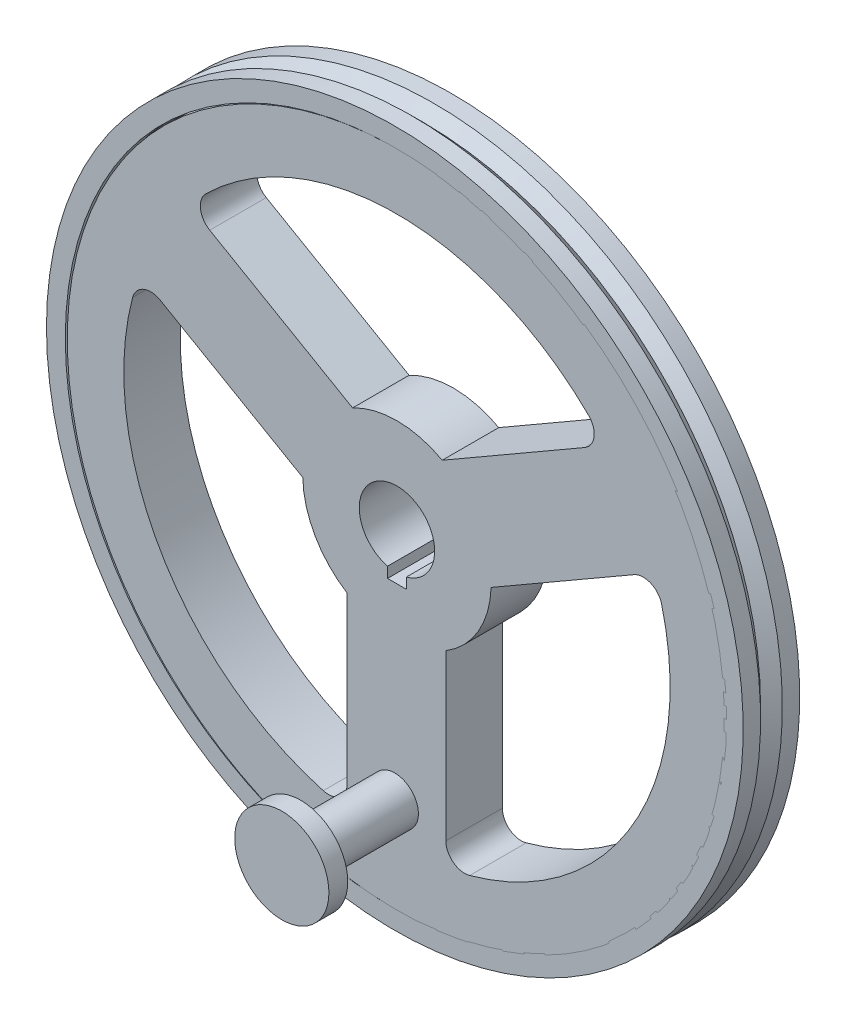
from build123d import *

# Parameters (mm, degrees)
SKETCH1_R           = 175
BOSS_EXTRUDE1_DEPTH = 30
SKETCH2_R           = 12.5
BOSS_EXTRUDE2_DEPTH = 50
SKETCH3_R           = 25
BOSS_EXTRUDE3_DEPTH = 10


with BuildPart() as part:
    # Sketch1 → Boss-Extrude1 (new body)
    with BuildSketch(Plane.XY):
        with Locations((1.124570284, 0)):
            Circle(SKETCH1_R)
        with BuildLine():
            Line((-25.294489225, -42.450362715), (-25.294489225, -129.994815683))
            ThreePointArc((-25.294489225, -129.994815683), (-29.252017923, -137.962785347), (-37.992197337, -139.624061289))
            ThreePointArc((-37.992197337, -139.624061289), (-124.579527681, -72.273644953), (-139.221399367, 36.441855094))
            ThreePointArc((-139.221399367, 36.441855094), (-133.404983694, 43.152516168), (-124.542366978, 42.588877746))
            Line((-124.542366978, 42.588877746), (-48.863229184, -1.104492831))
            ThreePointArc((-48.863229184, -1.104492831), (-42.313572676, -24.761416281), (-25.294489225, -42.450362715))
        make_face(mode=Mode.SUBTRACT)
        with BuildLine():
            Line((27.074988868, -130.125198957), (27.074988868, -42.738457802))
            ThreePointArc((27.074988868, -42.738457802), (44.287657296, -25.237827156), (51.09719255, -1.654395321))
            Line((51.09719255, -1.654395321), (126.91291278, 42.117831162))
            ThreePointArc((126.91291278, 42.117831162), (135.792141274, 42.674495606), (141.60093815, 35.935916171))
            ThreePointArc((141.60093815, 35.935916171), (126.567431819, -72.726119721), (39.737982837, -139.764102584))
            ThreePointArc((39.737982837, -139.764102584), (31.018172034, -138.082269388), (27.074988868, -130.125198957))
        make_face(mode=Mode.SUBTRACT)
        with BuildLine():
            ThreePointArc((21.124570284, 0), (16.935958585, -12.247448714), (6.124570284, -19.364916731))
            Line((6.124570284, -19.364916731), (6.124570284, -25))
            Line((6.124570284, -25), (-3.875429716, -25))
            Line((-3.875429716, -25), (-3.875429716, -19.364916731))
            ThreePointArc((-3.875429716, -19.364916731), (-11.12287843, 15.811388301), (21.124570284, 0))
        make_face(mode=Mode.SUBTRACT)
        with BuildLine():
            Line((-22.428992473, 44.104758037), (-98.244712703, 87.876984521))
            ThreePointArc((-98.244712703, 87.876984521), (-103.1664125, 95.288289741), (-100.235029962, 103.688145118))
            ThreePointArc((-100.235029962, 103.688145118), (1.385806713, 144.999764674), (102.857127382, 103.322247489))
            ThreePointArc((102.857127382, 103.322247489), (105.760522511, 94.929753221), (100.841088961, 87.536321211))
            Line((100.841088961, 87.536321211), (25.161951167, 43.842950634))
            ThreePointArc((25.161951167, 43.842950634), (1.399626231, 49.999243437), (-22.428992473, 44.104758037))
        make_face(mode=Mode.SUBTRACT)
    extrude(amount=BOSS_EXTRUDE1_DEPTH)

    # Sketch2 → Boss-Extrude2 (add)
    with BuildSketch(Plane.XY.offset(30)):
        with Locations((0, -125)):
            Circle(SKETCH2_R)
    extrude(amount=BOSS_EXTRUDE2_DEPTH)

    # Sketch3 → Boss-Extrude3 (add)
    with BuildSketch(Plane.XY.offset(80)):
        with Locations((0, -125)):
            Circle(SKETCH3_R)
    extrude(amount=BOSS_EXTRUDE3_DEPTH)


with BuildPart() as body_2:
    # Sketch5 → Revolve-Thin11 (revolve)
    with BuildSketch(Plane(origin=(0, 0, 0), x_dir=(0, 0, -1), z_dir=(1, 0, 0)), mode=Mode.PRIVATE) as revolve_thin11_sk:
        Polygon((-30, 174.922248704), (-24.922248704, 174.922248704), (-15, 165), (-5.077751296, 174.922248704), (0, 174.922248704), (0, 184.922248704), (-9.21988692, 184.922248704), (-15, 179.142135624), (-20.78011308, 184.922248704), (-30, 184.922248704), align=None)
    revolve(revolve_thin11_sk.sketch.rotate(Axis((0, 0, 0), (0, 0, 1)), 90), axis=Axis((0, 0, 0), (0, 0, 1)))


solid = Compound([part.part, body_2.part])
